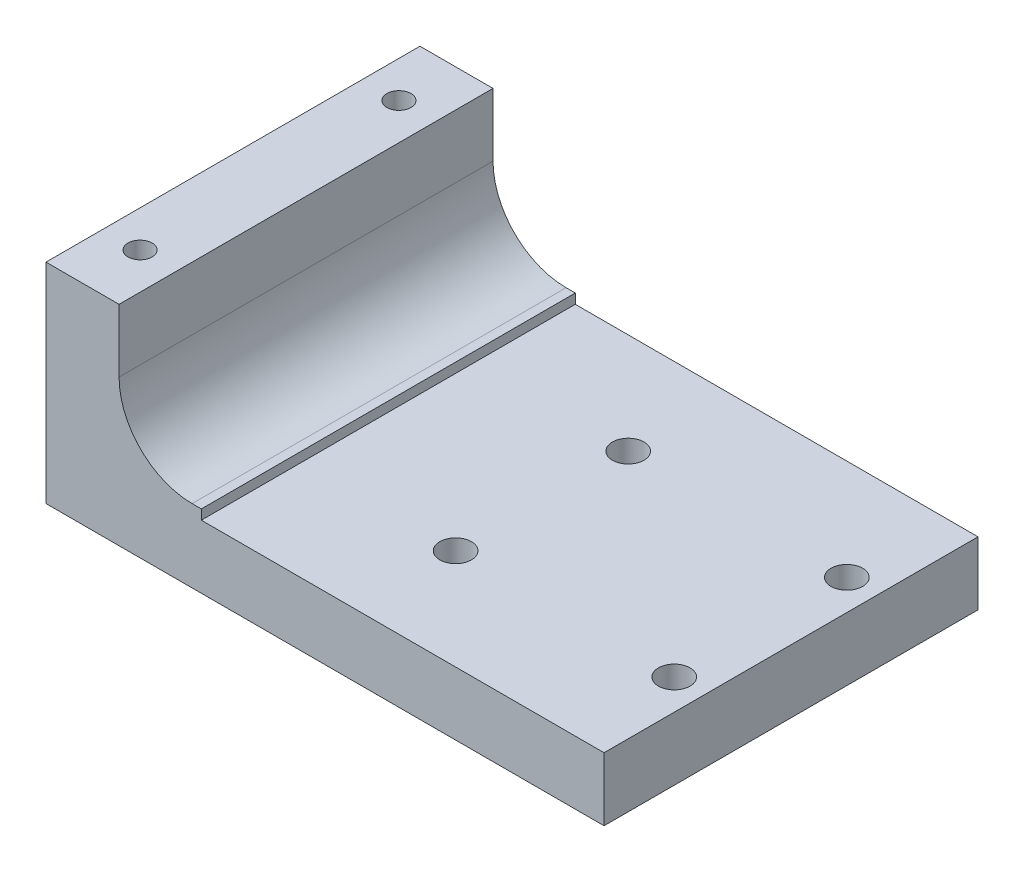
from build123d import *

# Parameters (mm, degrees)
EXTRUDE1_DEPTH            = 32.5
SKETCH2_W                 = 70
SKETCH2_H                 = 1.7
CUT_EXTRUDE1_DEPTH        = 123.291955991
M5_CLEARANCE_HOLE1_D      = 5.5
M5X0_8_TAPPED_HOLE1_D     = 4.2
M5X0_8_TAPPED_HOLE1_DEPTH = 19.05
M5X0_8_TAPPED_HOLE1_TIP   = 1.2618073


with BuildPart() as part:
    # Sketch1 → Extrude1 (new, symmetric)
    with BuildSketch(Plane.XY):
        with BuildLine():
            Line((0, 0), (97, 0))
            Line((97, 0), (97, 12.7))
            Line((97, 12.7), (25.4, 12.7))
            ThreePointArc((25.4, 12.7), (16.419743879, 16.419743879), (12.7, 25.4))
            Line((12.7, 25.4), (12.7, 36.35))
            Line((12.7, 36.35), (0, 36.35))
            Line((0, 36.35), (0, 0))
        make_face()
    extrude(amount=EXTRUDE1_DEPTH, both=True)

    # Sketch2 → Cut-Extrude1 (cut, through all)
    with BuildSketch(Plane(origin=(0, 0, -32.5), x_dir=(-1, 0, 0), z_dir=(0, 0, -1))):
        with Locations((-62, 11.85)):
            Rectangle(SKETCH2_W, SKETCH2_H)
    extrude(amount=-CUT_EXTRUDE1_DEPTH, mode=Mode.SUBTRACT)

    # M5 Clearance Hole1 (through all)
    with Locations(Plane.XZ):
        with Locations((53.7, 15), (91.7, 15), (91.7, -15), (53.7, -15)):
            Hole(M5_CLEARANCE_HOLE1_D / 2)

    # M5x0.8 Tapped Hole1
    with Locations(Plane(origin=(0, 36.35, 0), x_dir=(-1, 0, 0), z_dir=(0, 1, 0))):
        with Locations((-6.35, 22.5), (-6.35, -22.5)):
            Hole(M5X0_8_TAPPED_HOLE1_D / 2, depth=M5X0_8_TAPPED_HOLE1_DEPTH)
            with Locations((0, 0, -(M5X0_8_TAPPED_HOLE1_DEPTH + M5X0_8_TAPPED_HOLE1_TIP / 2))):  # 118° drill point
                Cone(0, M5X0_8_TAPPED_HOLE1_D / 2, M5X0_8_TAPPED_HOLE1_TIP, mode=Mode.SUBTRACT)


solid = part.part
